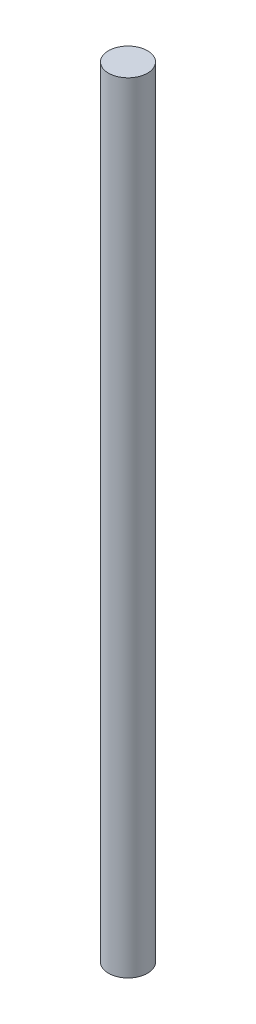
from build123d import *

# Parameters (mm, degrees)
SKETCH1_R           = 0.625
BOSS_EXTRUDE1_DEPTH = 25


with BuildPart() as part:
    # Sketch1 → Boss-Extrude1 (new body)
    with BuildSketch(Plane(origin=(0, 0, 0), x_dir=(1, 0, 0), z_dir=(0, 1, 0))):
        with Locations(Location((0, 0, 0), (0, 0, 270))):
            Circle(SKETCH1_R)
    extrude(amount=BOSS_EXTRUDE1_DEPTH)


solid = part.part
